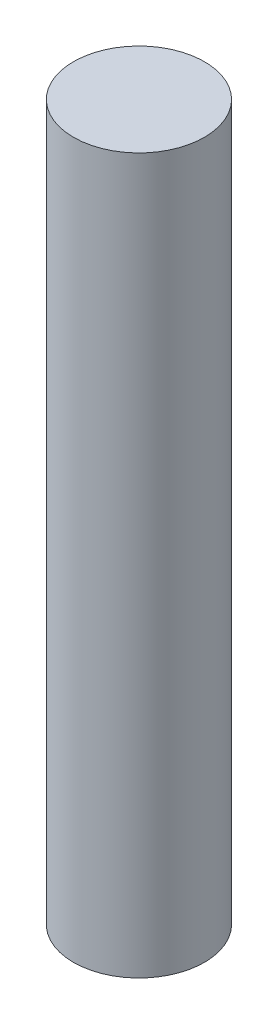
from build123d import *

# Parameters (mm, degrees)
SKETCH1_R           = 27.5
BOSS_EXTRUDE1_DEPTH = 300


with BuildPart() as part:
    # Sketch1 → Boss-Extrude1 (new body)
    with BuildSketch(Plane(origin=(0, 0, 0), x_dir=(1, 0, 0), z_dir=(0, 1, 0))):
        with Locations(Location((0, 0, 0), (0, 0, 270))):
            Circle(SKETCH1_R)
    extrude(amount=BOSS_EXTRUDE1_DEPTH)


solid = part.part
